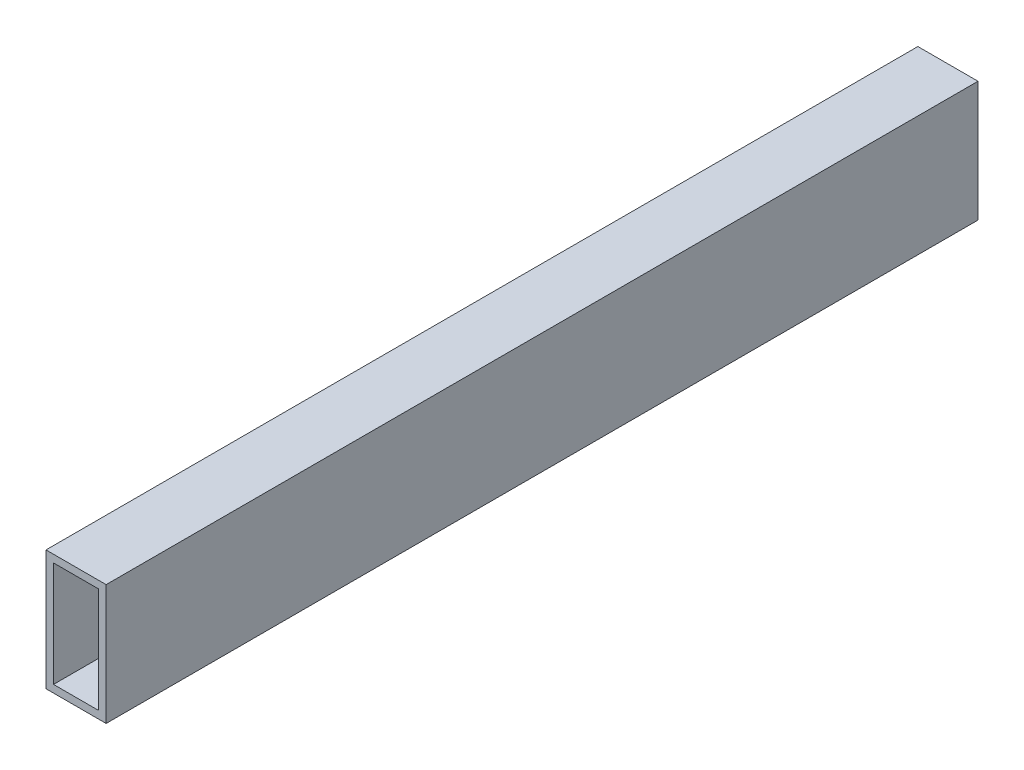
from build123d import *

# Parameters (mm, degrees)
SKETCH2_W           = 25.4
SKETCH2_H           = 50.8
SKETCH2_W_2         = 19.05
SKETCH2_H_2         = 44.45
BOSS_EXTRUDE1_DEPTH = 184.15


with BuildPart() as part:
    # Sketch2 → Boss-Extrude1 (new, symmetric)
    with BuildSketch(Plane.XY):
        Rectangle(SKETCH2_W, SKETCH2_H)
        Rectangle(SKETCH2_W_2, SKETCH2_H_2, mode=Mode.SUBTRACT)
    extrude(amount=BOSS_EXTRUDE1_DEPTH, both=True)


solid = part.part
